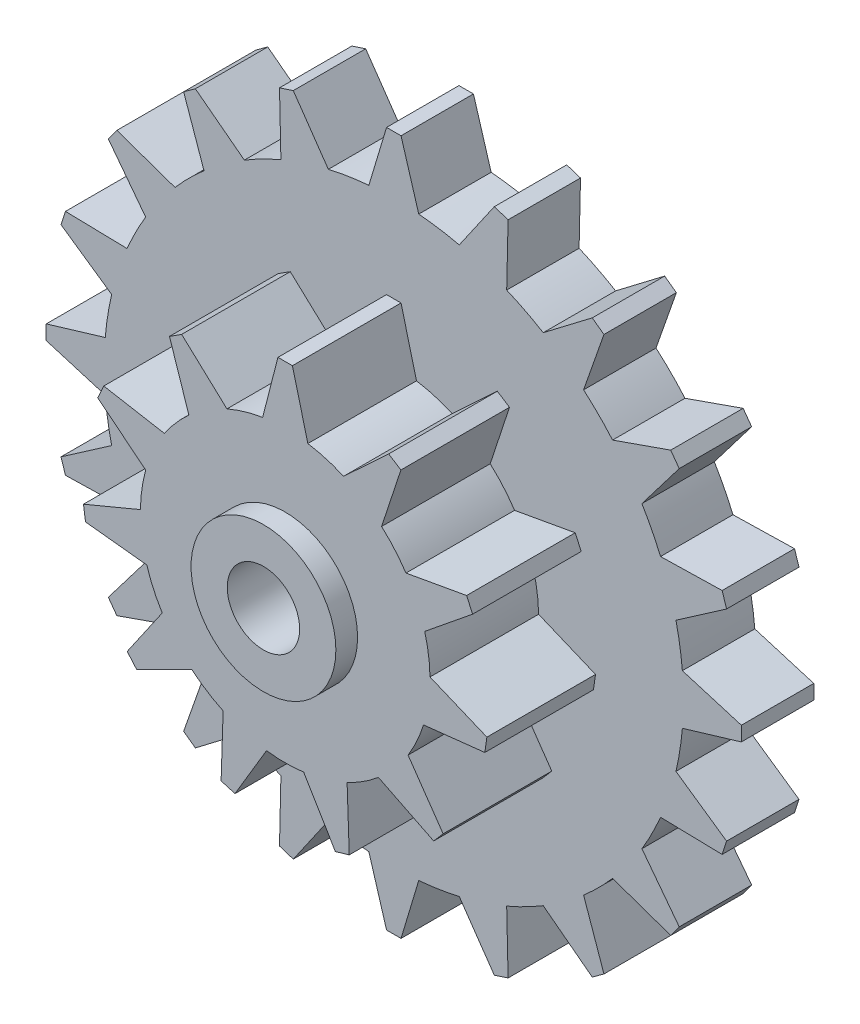
from build123d import *

# Parameters (mm, degrees)
SKETCH1_R                = 40
BOSS_EXTRUDE1_DEPTH      = 10
BOSS_EXTRUDE2_DEPTH      = 10
SKETCH3_R                = 20
BOSS_EXTRUDE3_DEPTH      = 15
BOSS_EXTRUDE4_START      = -15
BOSS_EXTRUDE4_DEPTH      = 15
BOSS_EXTRUDE6_DEPTH      = 3
BOSS_EXTRUDE6_DEPTH_BACK = 28
SKETCH5_R                = 10
SKETCH5_R_2              = 5
CUT_EXTRUDE1_DEPTH       = 74.430239003
CUT_EXTRUDE1_DEPTH_BACK  = 74.430239003
SKETCH6_R                = 5


with BuildPart() as part:
    # Sketch1 → Boss-Extrude1 (new body)
    with BuildSketch(Plane.XY):
        Circle(SKETCH1_R)
    extrude(amount=BOSS_EXTRUDE1_DEPTH)

    # Sketch2 → Boss-Extrude2 (add)
    with BuildSketch(Plane.XY.offset(10)):
        Polygon((-1, 48), (1, 48), (4, 38), (-4, 38), align=None)
        Polygon((7.938419721, 37.376215597), (13.881759214, 45.959729777), (15.783872246, 45.341695788), (15.546871851, 34.904079642), align=None)
        Polygon((19.09977161, 33.093786795), (27.404675116, 39.420600982), (29.022709104, 38.245030478), (25.571907565, 28.391504777), align=None)
        Polygon((28.391504777, 25.571907565), (38.245030478, 29.022709104), (39.420600982, 27.404675116), (33.093786795, 19.09977161), align=None)
        Polygon((34.904079642, 15.546871851), (45.341695788, 15.783872246), (45.959729777, 13.881759214), (37.376215597, 7.938419721), align=None)
        Polygon((38, 4), (48, 1), (48, -1), (38, -4), align=None)
        Polygon((37.376215597, -7.938419721), (45.959729777, -13.881759214), (45.341695788, -15.783872246), (34.904079642, -15.546871851), align=None)
        Polygon((33.093786795, -19.09977161), (39.420600982, -27.404675116), (38.245030478, -29.022709104), (28.391504777, -25.571907565), align=None)
        Polygon((25.571907565, -28.391504777), (29.022709104, -38.245030478), (27.404675116, -39.420600982), (19.09977161, -33.093786795), align=None)
        Polygon((15.546871851, -34.904079642), (15.783872246, -45.341695788), (13.881759214, -45.959729777), (7.938419721, -37.376215597), align=None)
        Polygon((4, -38), (1, -48), (-1, -48), (-4, -38), align=None)
        Polygon((-7.938419721, -37.376215597), (-13.881759214, -45.959729777), (-15.783872246, -45.341695788), (-15.546871851, -34.904079642), align=None)
        Polygon((-19.09977161, -33.093786795), (-27.404675116, -39.420600982), (-29.022709104, -38.245030478), (-25.571907565, -28.391504777), align=None)
        Polygon((-28.391504777, -25.571907565), (-38.245030478, -29.022709104), (-39.420600982, -27.404675116), (-33.093786795, -19.09977161), align=None)
        Polygon((-34.904079642, -15.546871851), (-45.341695788, -15.783872246), (-45.959729777, -13.881759214), (-37.376215597, -7.938419721), align=None)
        Polygon((-38, -4), (-48, -1), (-48, 1), (-38, 4), align=None)
        Polygon((-37.376215597, 7.938419721), (-45.959729777, 13.881759214), (-45.341695788, 15.783872246), (-34.904079642, 15.546871851), align=None)
        Polygon((-33.093786795, 19.09977161), (-39.420600982, 27.404675116), (-38.245030478, 29.022709104), (-28.391504777, 25.571907565), align=None)
        Polygon((-25.571907565, 28.391504777), (-29.022709104, 38.245030478), (-27.404675116, 39.420600982), (-19.09977161, 33.093786795), align=None)
        Polygon((-15.546871851, 34.904079642), (-15.783872246, 45.341695788), (-13.881759214, 45.959729777), (-7.938419721, 37.376215597), align=None)
    extrude(amount=-BOSS_EXTRUDE2_DEPTH)

    # Sketch3 → Boss-Extrude3 (add)
    with BuildSketch(Plane.XY.offset(10)):
        Circle(SKETCH3_R)
    extrude(amount=BOSS_EXTRUDE3_DEPTH)

    # Sketch4 → Boss-Extrude4 (add)
    with BuildSketch(Plane.XY.offset(25).offset(BOSS_EXTRUDE4_START)):
        with BuildLine():
            ThreePointArc((-13.298978315, 14.937776802), (-10.804143602, 16.830641136), (-8.044414634, 18.310854518))
            Line((-8.044414634, 18.310854518), (-14.296689356, 24.095739737))
            Line((-14.296689356, 24.095739737), (-15.979196422, 23.014458102))
            Line((-15.979196422, 23.014458102), (-13.298978315, 14.937776802))
        make_face()
        with BuildLine():
            Line((1, 28), (-1, 28))
            Line((-1, 28), (-3.11184063, 19.756428015))
            ThreePointArc((-3.11184063, 19.756428015), (-1.560679292, 19.939014021), (0, 20))
            ThreePointArc((0, 20), (1.570955262, 19.93820703), (3.132203125, 19.753209957))
            Line((3.132203125, 19.753209957), (1, 28))
        make_face()
        with BuildLine():
            Line((14.296689356, 24.095739737), (8.063284469, 18.302552925))
            ThreePointArc((8.063284469, 18.302552925), (10.821486224, 16.819495709), (13.314368522, 14.924060803))
            Line((13.314368522, 14.924060803), (15.979196422, 23.014458102))
            Line((15.979196422, 23.014458102), (14.296689356, 24.095739737))
        make_face()
        with BuildLine():
            Line((25.054280857, 12.541252359), (16.67837372, 11.037746602))
            ThreePointArc((16.67837372, 11.037746602), (18.196919426, 8.298923027), (19.269315989, 5.356627793))
            Line((19.269315989, 5.356627793), (25.885110883, 10.721988369))
            Line((25.885110883, 10.721988369), (25.054280857, 12.541252359))
        make_face()
        with BuildLine():
            Line((27.857315211, -2.99499403), (19.99819716, 0.268533721))
            ThreePointArc((19.99819716, 0.268533721), (19.999549285, 0.134269886), (20, 0))
            ThreePointArc((20, 0), (19.775336098, -2.989328052), (19.10639178, -5.911496693))
            Line((19.10639178, -5.911496693), (27.572685534, -4.974636914))
            Line((27.572685534, -4.974636914), (27.857315211, -2.99499403))
        make_face()
        with BuildLine():
            ThreePointArc((-19.263784352, 5.376486999), (-18.188355556, 8.317675286), (-16.666987586, 11.054932149))
            Line((-16.666987586, 11.054932149), (-25.054280857, 12.541252359))
            Line((-25.054280857, 12.541252359), (-25.885110883, 10.721988369))
            Line((-25.885110883, 10.721988369), (-19.263784352, 5.376486999))
        make_face()
        with BuildLine():
            ThreePointArc((-19.112474968, -5.891799437), (-19.797893134, -2.836093696), (-19.997909742, 0.289146933))
            Line((-19.997909742, 0.289146933), (-27.857315211, -2.99499403))
            Line((-27.857315211, -2.99499403), (-27.572685534, -4.974636914))
            Line((-27.572685534, -4.974636914), (-19.112474968, -5.891799437))
        make_face()
        with BuildLine():
            ThreePointArc((-12.893089824, -15.289481181), (-15.121739527, -13.089422969), (-16.979636854, -10.568440392))
            Line((-16.979636854, -10.568440392), (-21.815848816, -17.580350976))
            Line((-21.815848816, -17.580350976), (-20.506127348, -19.091850125))
            Line((-20.506127348, -19.091850125), (-12.893089824, -15.289481181))
        make_face()
        with BuildLine():
            ThreePointArc((-2.580239759, -19.832860681), (-5.644540466, -19.186952935), (-8.570449237, -18.070622565))
            Line((-8.570449237, -18.070622565), (-8.848004565, -26.584070704))
            Line((-8.848004565, -26.584070704), (-6.929018618, -27.147535818))
            Line((-6.929018618, -27.147535818), (-2.580239759, -19.832860681))
        make_face()
        with BuildLine():
            Line((8.848004565, -26.584070704), (8.551818198, -18.079447047))
            ThreePointArc((8.551818198, -18.079447047), (5.624760311, -19.192760912), (2.559795457, -19.835509754))
            Line((2.559795457, -19.835509754), (6.929018618, -27.147535818))
            Line((6.929018618, -27.147535818), (8.848004565, -26.584070704))
        make_face()
        with BuildLine():
            Line((21.815848816, -17.580350976), (16.968734301, -10.585936718))
            ThreePointArc((16.968734301, -10.585936718), (15.108239432, -13.10500291), (12.87732318, -15.302762748))
            Line((12.87732318, -15.302762748), (20.506127348, -19.091850125))
            Line((20.506127348, -19.091850125), (21.815848816, -17.580350976))
        make_face()
    extrude(amount=BOSS_EXTRUDE4_DEPTH)

    # Sketch5 → Boss-Extrude6 (add, two sides: drawn at the far end of the back side and taken through both)
    with BuildSketch(Plane.XY.offset(25).offset(-BOSS_EXTRUDE6_DEPTH_BACK)):
        Circle(SKETCH5_R)
        Circle(SKETCH5_R_2, mode=Mode.SUBTRACT)
    extrude(amount=BOSS_EXTRUDE6_DEPTH + BOSS_EXTRUDE6_DEPTH_BACK)

    # Sketch6 → Cut-Extrude1 (cut, two sides: drawn at the far end of the back side and taken through both)
    with BuildSketch(Plane.XY.offset(25).offset(-CUT_EXTRUDE1_DEPTH_BACK)):
        Circle(SKETCH6_R)
    extrude(amount=CUT_EXTRUDE1_DEPTH + CUT_EXTRUDE1_DEPTH_BACK, mode=Mode.SUBTRACT)


solid = part.part
